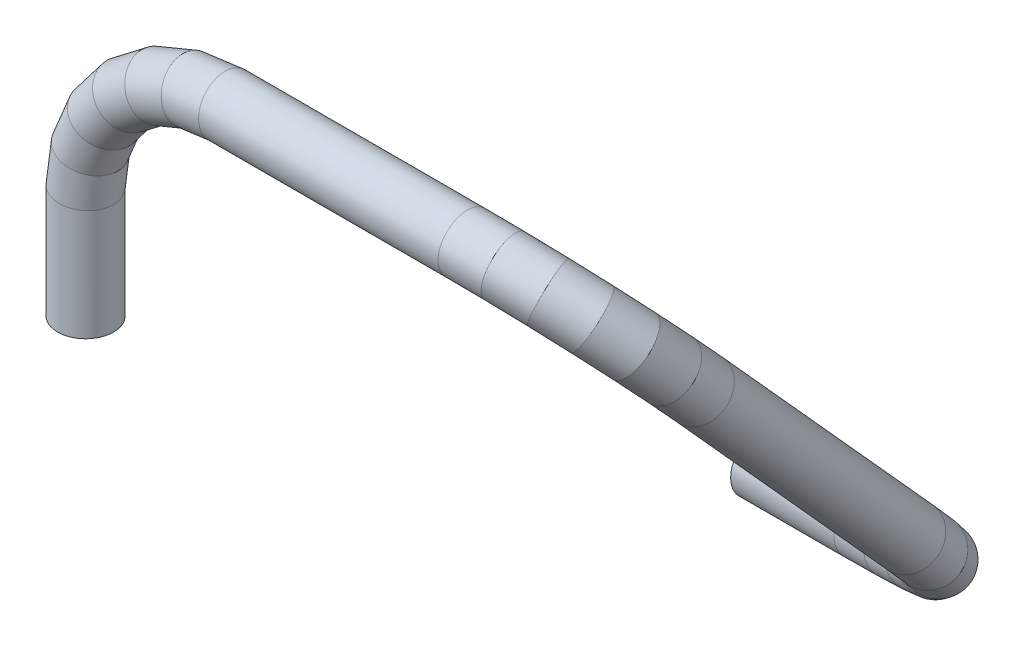
from build123d import *

# Parameters (mm, degrees)
PROFILE_R   = 4.7625
PROFILE_R_2 = 3.8735


with BuildPart() as part:
    # Tube: sweep along a curve in space
    with BuildLine() as tube_path:
        Line((66.7, 56.886703457, -67.794933216), (84.5, 56.886703457, -67.794933216))
        Line((84.5, 56.886703457, -67.794933216), (90.711657082, 57.493778578, -67.247006029))
        Line((90.711657082, 57.493778578, -67.247006029), (96.5, 59.273632775, -65.6405648))
        Line((96.5, 59.273632775, -65.6405648), (101.470562748, 62.104971926, -63.085085844))
        Line((101.470562748, 62.104971926, -63.085085844), (105.284609691, 65.794844946, -59.754720829))
        Line((105.284609691, 65.794844946, -59.754720829), (107.682219831, 70.091793087, -55.876428627))
        Line((107.682219831, 70.091793087, -55.876428627), (108.5, 74.702986434, -51.714508442))
        Line((108.5, 74.702986434, -51.714508442), (108.5, 114.183717023, -16.080424774))
        Line((108.5, 114.183717023, -16.080424774), (107.682219831, 118.794910371, -11.918504589))
        Line((107.682219831, 118.794910371, -11.918504589), (105.284609691, 123.091858512, -8.040212387))
        Line((105.284609691, 123.091858512, -8.040212387), (101.470562748, 126.781731532, -4.709847372))
        Line((101.470562748, 126.781731532, -4.709847372), (96.5, 129.613070682, -2.154368416))
        Line((96.5, 129.613070682, -2.154368416), (90.711657082, 131.392924879, -0.547927187))
        Line((90.711657082, 131.392924879, -0.547927187), (84.5, 132, 0))
        Line((84.5, 132, 0), (44, 132, 0))
        Line((44, 132, 0), (37.788342918, 131.182219831, 0))
        Line((37.788342918, 131.182219831, 0), (32, 128.784609691, 0))
        Line((32, 128.784609691, 0), (27.029437252, 124.970562748, 0))
        Line((27.029437252, 124.970562748, 0), (23.215390309, 120, 0))
        Line((23.215390309, 120, 0), (20.817780169, 114.211657082, 0))
        Line((20.817780169, 114.211657082, 0), (20, 108, 0))
        Line((20, 108, 0), (20, 88.9, 0))
    # Profile → Tube (sweep)
    with BuildSketch(Plane(origin=(66.7, 0, 0), x_dir=(0, 0, -1), z_dir=(1, 0, 0))):
        with Locations((67.794933216, 56.886703457)):
            Circle(PROFILE_R)
        with Locations((67.794933216, 56.886703457)):
            Circle(PROFILE_R_2, mode=Mode.SUBTRACT)
    sweep(path=tube_path.line, transition=Transition.RIGHT)


solid = part.part
